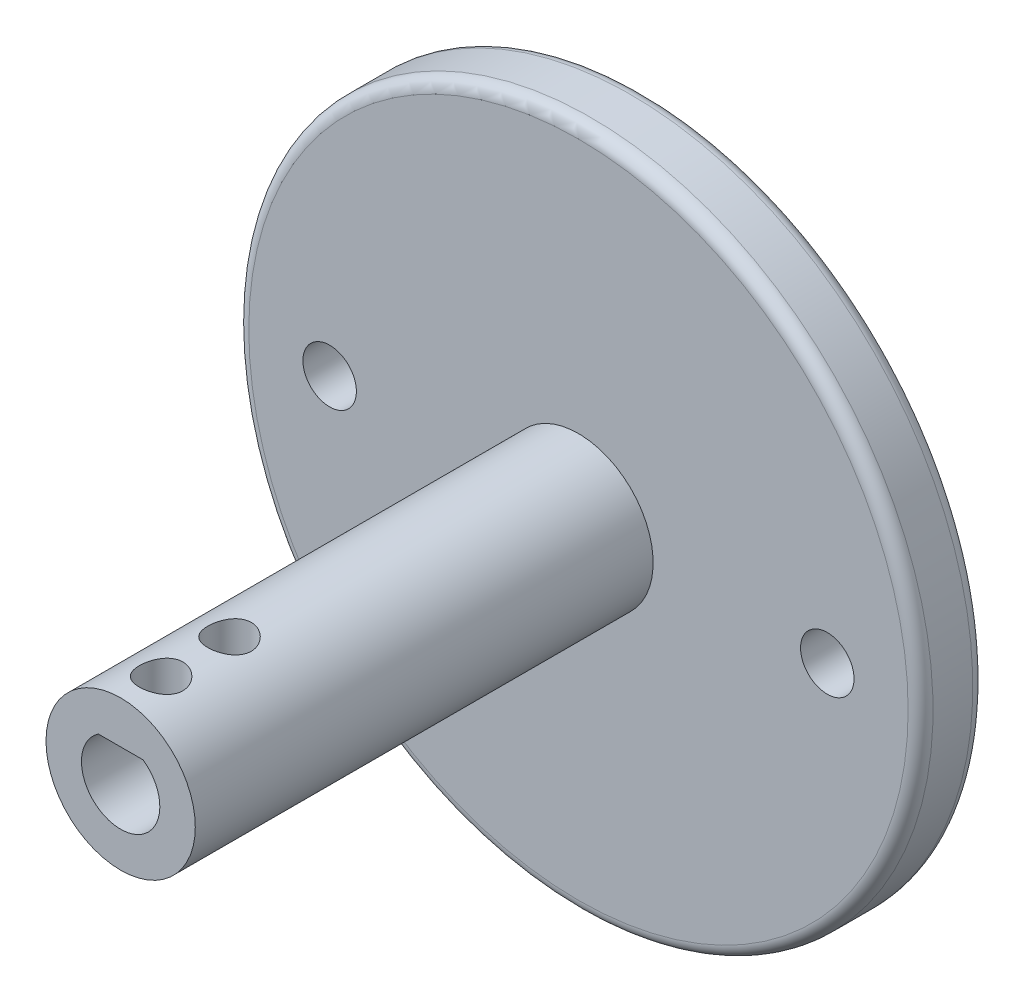
from build123d import *

# Parameters (mm, degrees)
CROQUIS1_R                   = 6
SALIENTE_EXTRUIR1_DEPTH      = 40
CROQUIS2_R                   = 1.75
CORTAR_EXTRUIR1_DEPTH        = 7.5
SALIENTE_EXTRUIR2_DEPTH      = 2
SALIENTE_EXTRUIR2_DEPTH_BACK = 3.2
CROQUIS3_R                   = 27.5
CORTAR_EXTRUIR2_DEPTH        = 58.240719845
CORTAR_EXTRUIR2_DEPTH_BACK   = 5.2
CROQUIS5_R                   = 2.15
REDONDEO1_R                  = 1


with BuildPart() as part:
    # Croquis1 → Saliente-Extruir1 (new body)
    with BuildSketch(Plane.XY):
        Circle(CROQUIS1_R)
        with BuildLine():
            Line((-1.8, 2.585053191), (1.8, 2.585053191))
            ThreePointArc((1.8, 2.585053191), (0, -3.15), (-1.8, 2.585053191))
        make_face(mode=Mode.SUBTRACT)
    extrude(amount=SALIENTE_EXTRUIR1_DEPTH)

    # Croquis2 → Cortar-Extruir1 (cut)
    with BuildSketch(Plane(origin=(0, 2.585053191, 0), x_dir=(1, 0, 0), z_dir=(0, 1, 0))):
        with Locations((0, -36.75)):
            Circle(CROQUIS2_R)
        with Locations((0, -31.25)):
            Circle(CROQUIS2_R)
    extrude(amount=CORTAR_EXTRUIR1_DEPTH, mode=Mode.SUBTRACT)

    # Croquis3 → Saliente-Extruir2 (add, two sides: drawn at the far end of the back side and taken through both)
    with BuildSketch(Plane(origin=(0, 0, 0), x_dir=(-1, 0, 0), z_dir=(0, 0, -1)).offset(-SALIENTE_EXTRUIR2_DEPTH_BACK)):
        Circle(CROQUIS3_R)
    extrude(amount=SALIENTE_EXTRUIR2_DEPTH + SALIENTE_EXTRUIR2_DEPTH_BACK)

    # Croquis5 → Cortar-Extruir2 (cut, two sides: drawn at the far end of the back side and taken through both)
    with BuildSketch(Plane(origin=(0, 0, -2), x_dir=(-1, 0, 0), z_dir=(0, 0, -1)).offset(-CORTAR_EXTRUIR2_DEPTH_BACK)):
        with Locations(Location((-20, 0, 0), (0, 0, 180))):
            Circle(CROQUIS5_R)
        with Locations(Location((20, 0, 0), (0, 0, 180))):
            Circle(CROQUIS5_R)
    extrude(amount=CORTAR_EXTRUIR2_DEPTH + CORTAR_EXTRUIR2_DEPTH_BACK, mode=Mode.SUBTRACT)

    # Redondeo1
    redondeo1_edges = [part.edges().sort_by_distance(p)[0] for p in [
        (27.5, 0, 3.2),
        (27.5, 0, -2),
    ]]
    fillet(redondeo1_edges, radius=REDONDEO1_R)


solid = part.part
